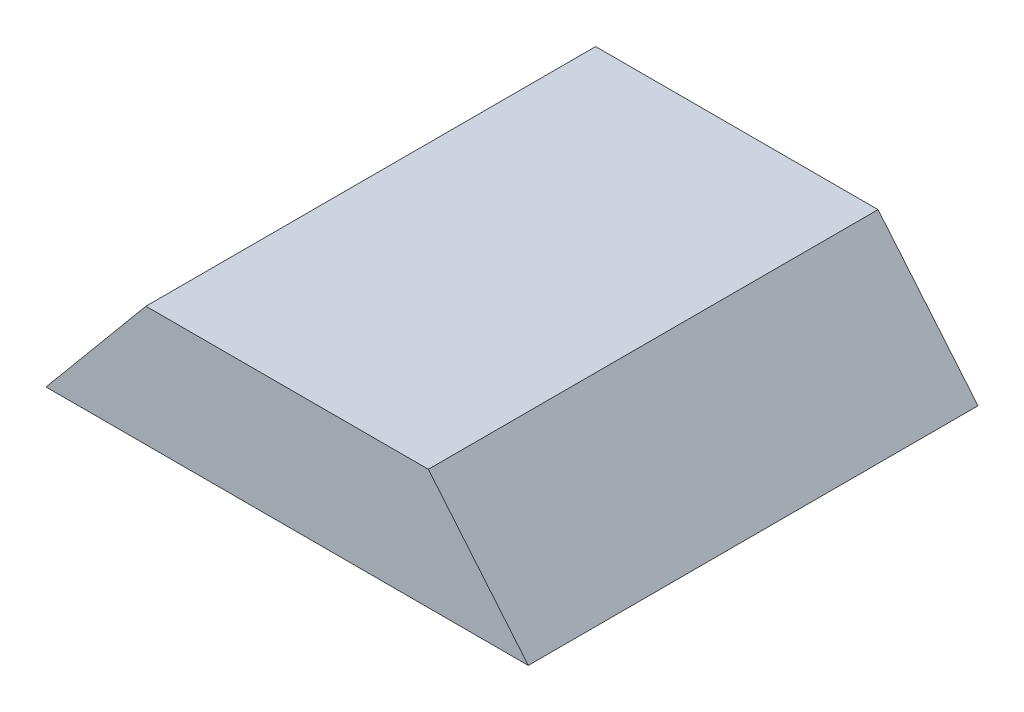
from build123d import *

# Parameters (mm, degrees)
SALIENTE_EXTRUIR1_DEPTH = 104
SALIENTE_EXTRUIR2_DEPTH = 1


with BuildPart() as part:
    # Croquis1 → Saliente-Extruir1 (new body)
    with BuildSketch(Plane.XY):
        Polygon((-55, 0), (-56.301708279, 0), (-32.968374946, 28), (32.968374946, 28), (56.301708279, 0), (55, 0), (32.5, 27), (-32.5, 27), align=None)
    extrude(amount=SALIENTE_EXTRUIR1_DEPTH)

    # Croquis4 → Saliente-Extruir2 (add)
    with BuildSketch(Plane.XY.offset(104)):
        Polygon((-56.301708279, 0), (56.301708279, 0), (32.968374946, 28), (-32.968374946, 28), align=None)
    extrude(amount=SALIENTE_EXTRUIR2_DEPTH)


solid = part.part
